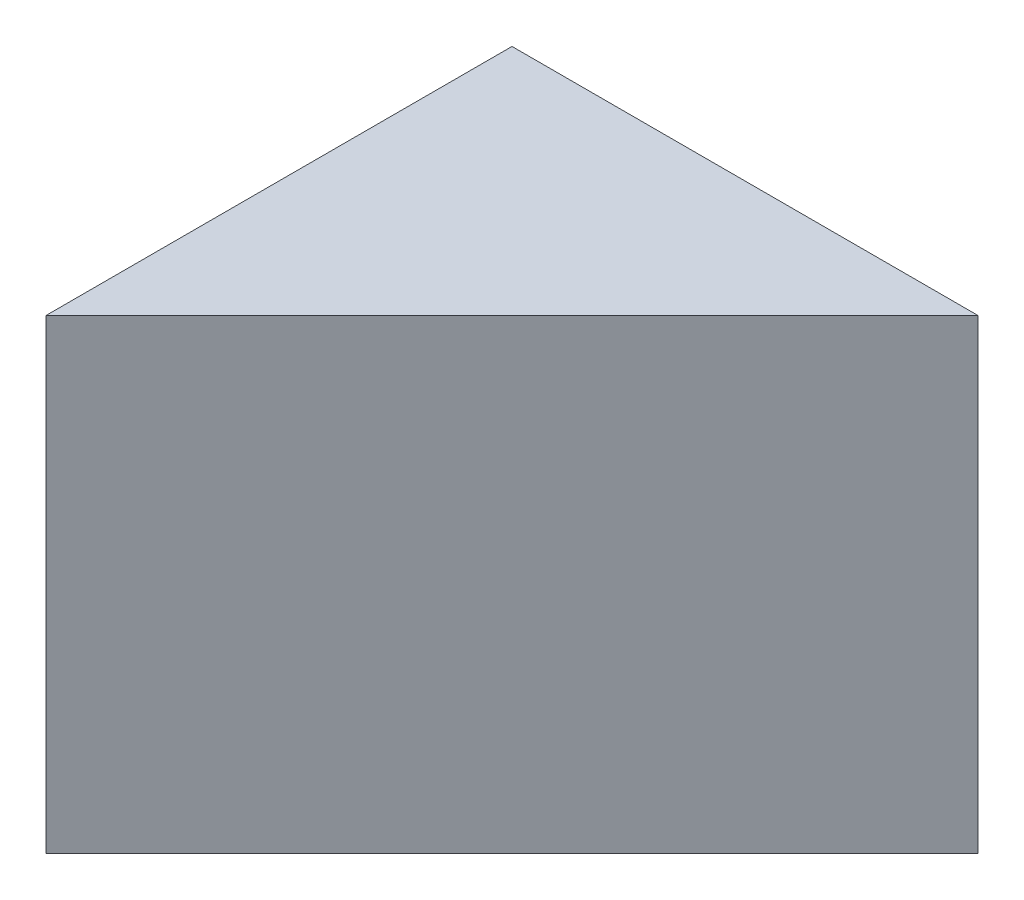
from build123d import *

# Parameters (mm, degrees)
BOSS_EXTRUDE1_DEPTH = 12.5


with BuildPart() as part:
    # Sketch1 → Boss-Extrude1 (new, symmetric)
    with BuildSketch(Plane(origin=(0, 0, 0), x_dir=(1, 0, 0), z_dir=(0, 1, 0))):
        Polygon((12.5, 12.5), (-12.5, 12.5), (-12.5, -12.5), align=None)
    extrude(amount=BOSS_EXTRUDE1_DEPTH, both=True)


solid = part.part
